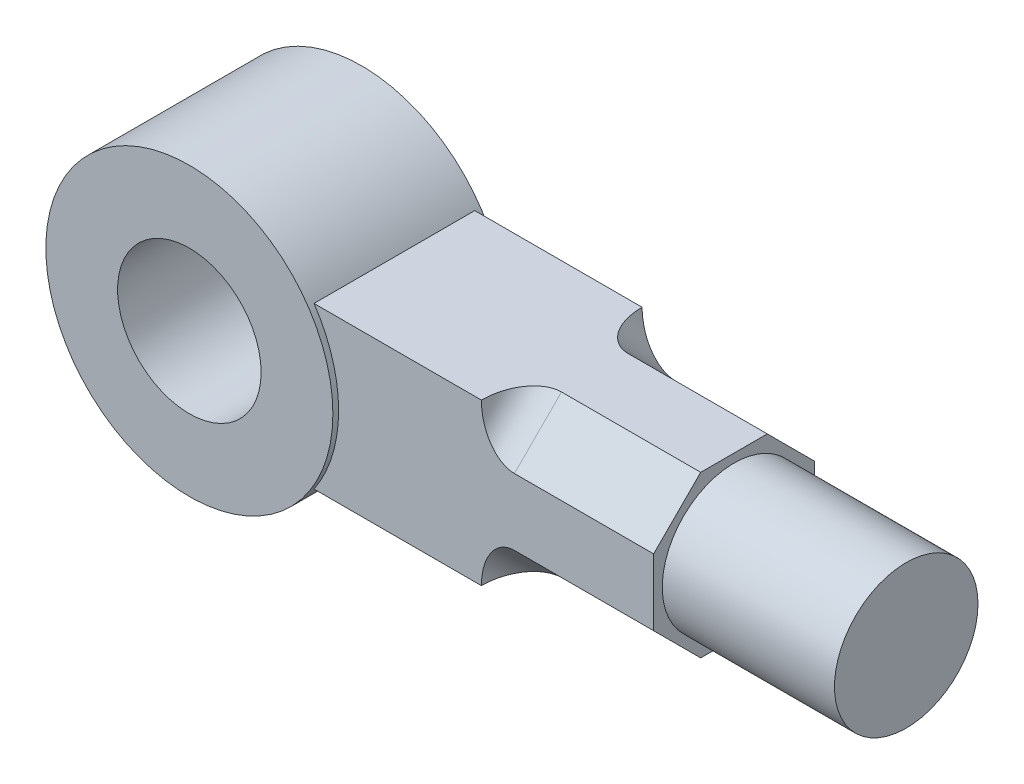
from build123d import *

# Parameters (mm, degrees)
SKETCH1_R           = 25
SKETCH1_R_2         = 12.5
BOSS_EXTRUDE1_DEPTH = 30
BOSS_EXTRUDE2_DEPTH = 14
BOSS_EXTRUDE5_DEPTH = 30
FILLET6_R           = 5.75
FILLET7_R           = 5.75
FILLET8_R           = 5.75
FILLET9_R           = 5.75
SKETCH7_R           = 12.5
BOSS_EXTRUDE6_DEPTH = 30


with BuildPart() as part:
    # Sketch1 → Boss-Extrude1 (new body)
    with BuildSketch(Plane.XY):
        Circle(SKETCH1_R)
        Circle(SKETCH1_R_2, mode=Mode.SUBTRACT)
    extrude(amount=BOSS_EXTRUDE1_DEPTH)

    # Sketch2 → Boss-Extrude2 (add, symmetric)
    with BuildSketch(Plane(origin=(0, 0, 15), x_dir=(-1, 0, 0), z_dir=(0, 0, -1))):
        with BuildLine():
            ThreePointArc((-20.712315177, 14), (-25, 0), (-20.712315177, -14))
            Line((-20.712315177, -14), (-49.87018371, -14))
            Line((-49.87018371, -14), (-49.87018371, 14))
            Line((-49.87018371, 14), (-20.712315177, 14))
        make_face()
    extrude(amount=BOSS_EXTRUDE2_DEPTH, both=True)

    # Sketch6 → Boss-Extrude5 (add)
    with BuildSketch(Plane(origin=(49.87018371, 0, 0), x_dir=(0, 0, -1), z_dir=(1, 0, 0))):
        Polygon((-9.201010127, 14), (-20.798989873, 14), (-29, 5.798989873), (-29, -5.798989873), (-20.798989873, -14), (-9.201010127, -14), (-1, -5.798989873), (-1, 5.798989873), align=None)
    extrude(amount=BOSS_EXTRUDE5_DEPTH)

    # Fillet6
    fillet6_edges = [part.edges().sort_by_distance(p)[0] for p in [
        (49.87018371, 9.899494937, 24.899494937),
    ]]
    fillet(fillet6_edges, radius=FILLET6_R)

    # Fillet7
    fillet7_edges = [part.edges().sort_by_distance(p)[0] for p in [
        (49.87018371, 9.899494937, 5.100505063),
    ]]
    fillet(fillet7_edges, radius=FILLET7_R)

    # Fillet8
    fillet8_edges = [part.edges().sort_by_distance(p)[0] for p in [
        (49.87018371, -9.899494937, 24.899494937),
    ]]
    fillet(fillet8_edges, radius=FILLET8_R)

    # Fillet9
    fillet9_edges = [part.edges().sort_by_distance(p)[0] for p in [
        (49.87018371, -9.899494937, 5.100505063),
    ]]
    fillet(fillet9_edges, radius=FILLET9_R)

    # Sketch7 → Boss-Extrude6 (add)
    with BuildSketch(Plane(origin=(79.87018371, 0, 0), x_dir=(0, 0, -1), z_dir=(1, 0, 0))):
        with Locations((-15, 0)):
            Circle(SKETCH7_R)
    extrude(amount=BOSS_EXTRUDE6_DEPTH)


solid = part.part
